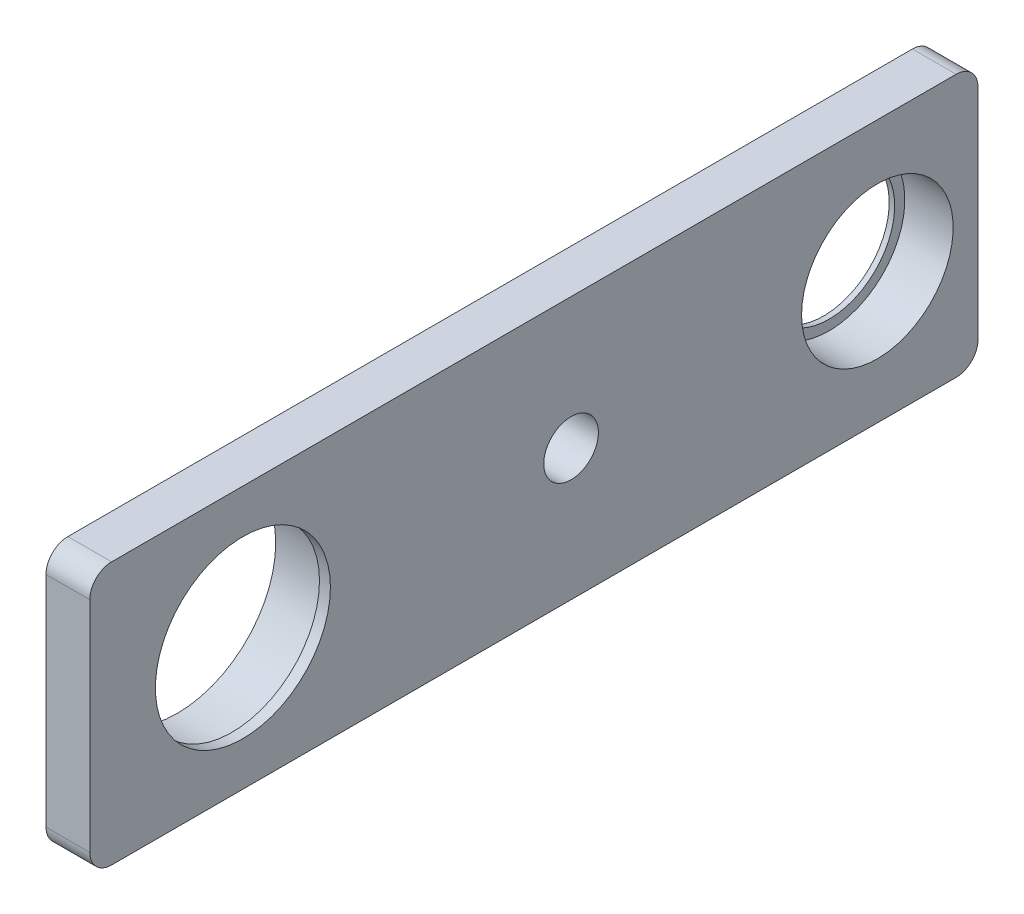
from build123d import *

# Parameters (mm, degrees)
SKETCH1_W            = 123.825
SKETCH1_H            = 38.1
SKETCH1_R            = 14.2875
SKETCH1_R_2          = 3.96875
SKETCH1_R_3          = 4.7625
BOSS_EXTRUDE1_DEPTH  = 6.35
BOSS_EXTRUDE3_START  = -1.5875
SKETCH3_R            = 14.2875
SKETCH3_R_2          = 12.7
BOSS_EXTRUDE3_DEPTH  = 1.5875
BOSS_EXTRUDE5_START  = 3.175
SKETCH5_R            = 15.875
SKETCH5_R_2          = 14.2875
BOSS_EXTRUDE5_DEPTH  = 3.175
SKETCH17_W           = 6.35
SKETCH17_H           = 38.1
BOSS_EXTRUDE8_DEPTH  = 5.08
CUT_EXTRUDE3_REACH   = 136.568
SKETCH16_R           = 11
BOSS_EXTRUDE9_START  = 0.6604
SKETCH18_R           = 12.7
SKETCH18_R_2         = 11
BOSS_EXTRUDE9_DEPTH  = 0.6604
FILLET2_R            = 3.175
BOSS_EXTRUDE10_START = 0.79375
SKETCH19_R           = 12.7
SKETCH19_R_2         = 9.525
BOSS_EXTRUDE10_DEPTH = 0.79375


with BuildPart() as part:
    # Sketch1 → Boss-Extrude1 (new body)
    with BuildSketch(Plane(origin=(0, 0, 0), x_dir=(0, 0, -1), z_dir=(1, 0, 0))):
        with Locations((61.9125, 19.05)):
            Rectangle(SKETCH1_W, SKETCH1_H)
        with Locations((22.225, 19.05)):
            Circle(SKETCH1_R, mode=Mode.SUBTRACT)
        with Locations((69.85, 19.05)):
            Circle(SKETCH1_R_2, mode=Mode.SUBTRACT)
        with Locations((114.3, 19.05)):
            Circle(SKETCH1_R_3, mode=Mode.SUBTRACT)
    extrude(amount=BOSS_EXTRUDE1_DEPTH)

    # Sketch3 → Boss-Extrude3 (add)
    with BuildSketch(Plane(origin=(6.35, 0, 0), x_dir=(0, 0, -1), z_dir=(1, 0, 0)).offset(BOSS_EXTRUDE3_START)):
        with Locations((22.225, 19.05)):
            Circle(SKETCH3_R)
        with Locations((22.225, 19.05)):
            Circle(SKETCH3_R_2, mode=Mode.SUBTRACT)
    extrude(amount=BOSS_EXTRUDE3_DEPTH)

    # Sketch5 → Boss-Extrude5 (add)
    with BuildSketch(Plane.ZY.offset(BOSS_EXTRUDE5_START)):
        with Locations((-22.225, 19.05)):
            Circle(SKETCH5_R)
        with Locations((-22.225, 19.05)):
            Circle(SKETCH5_R_2, mode=Mode.SUBTRACT)
    extrude(amount=-BOSS_EXTRUDE5_DEPTH)

    # Sketch17 → Boss-Extrude8 (add)
    with BuildSketch(Plane(origin=(0, 0, -123.825), x_dir=(-1, 0, 0), z_dir=(0, 0, -1))):
        with Locations((-3.175, 19.05)):
            Rectangle(SKETCH17_W, SKETCH17_H)
    extrude(amount=BOSS_EXTRUDE8_DEPTH)

    # Sketch16 → Cut-Extrude3 (cut, up to next)
    with BuildSketch(Plane.ZY, mode=Mode.PRIVATE) as cut_extrude3_sk1:
        with Locations((-114.3, 19.05)):
            Circle(SKETCH16_R)
    cut_extrude3_tool1 = extrude(cut_extrude3_sk1.sketch, amount=-CUT_EXTRUDE3_REACH, mode=Mode.PRIVATE) & part.part
    add(cut_extrude3_tool1.solids().sort_by_distance((0, 19.05, -114.3))[0], mode=Mode.SUBTRACT)

    # Sketch18 → Boss-Extrude9 (add)
    with BuildSketch(Plane.ZY.offset(BOSS_EXTRUDE9_START)):
        with Locations((-114.3, 19.05)):
            Circle(SKETCH18_R)
        with Locations((-114.3, 19.05)):
            Circle(SKETCH18_R_2, mode=Mode.SUBTRACT)
    extrude(amount=-BOSS_EXTRUDE9_DEPTH)

    # Fillet2
    fillet2_edges = [part.edges().sort_by_distance(p)[0] for p in [
        (3.175, 0, -128.905),
        (3.175, 38.1, -128.905),
        (3.175, 38.1, 0),
        (3.175, 0, 0),
    ]]
    fillet(fillet2_edges, radius=FILLET2_R)

    # Sketch19 → Boss-Extrude10 (add)
    with BuildSketch(Plane.ZY.offset(0.6604).offset(BOSS_EXTRUDE10_START)):
        with Locations((-114.3, 19.05)):
            Circle(SKETCH19_R)
        with Locations((-114.3, 19.05)):
            Circle(SKETCH19_R_2, mode=Mode.SUBTRACT)
    extrude(amount=-BOSS_EXTRUDE10_DEPTH)


solid = part.part
